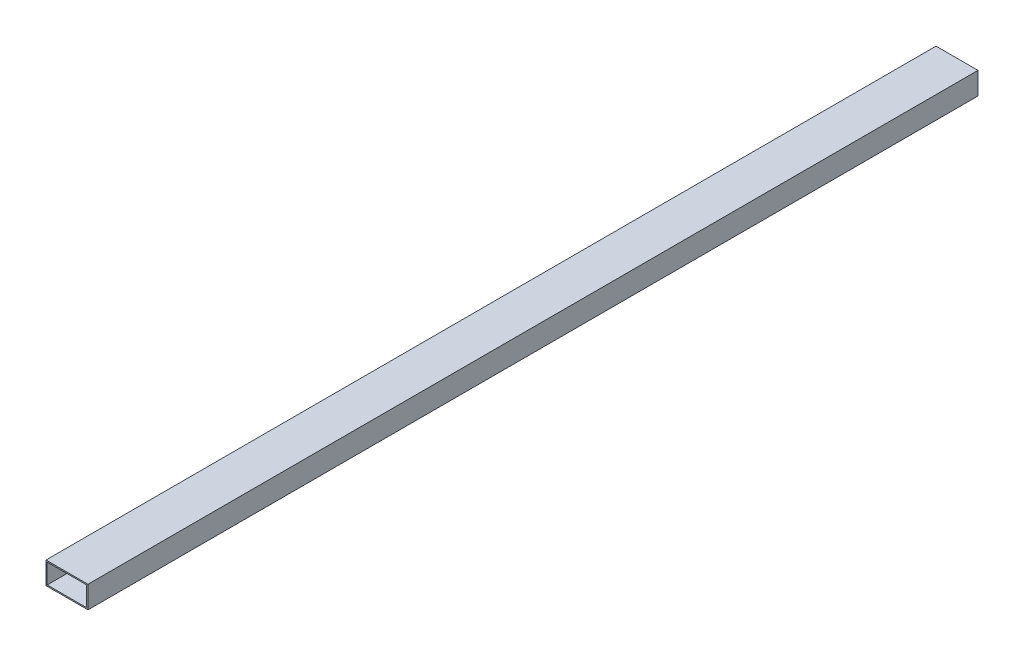
from build123d import *

# Parameters (mm, degrees)
SKETCH1_W           = 53.975
SKETCH1_H           = 28.575
SKETCH1_W_2         = 50.8
SKETCH1_H_2         = 25.4
EXTRUDE_THIN1_DEPTH = 1144.5875


with BuildPart() as part:
    # Sketch1 → Extrude-Thin1 (new body)
    with BuildSketch(Plane.XY):
        with Locations((25.4, -12.7)):
            Rectangle(SKETCH1_W, SKETCH1_H)
        with Locations((25.4, -12.7)):
            Rectangle(SKETCH1_W_2, SKETCH1_H_2, mode=Mode.SUBTRACT)
    extrude(amount=EXTRUDE_THIN1_DEPTH)


solid = part.part
